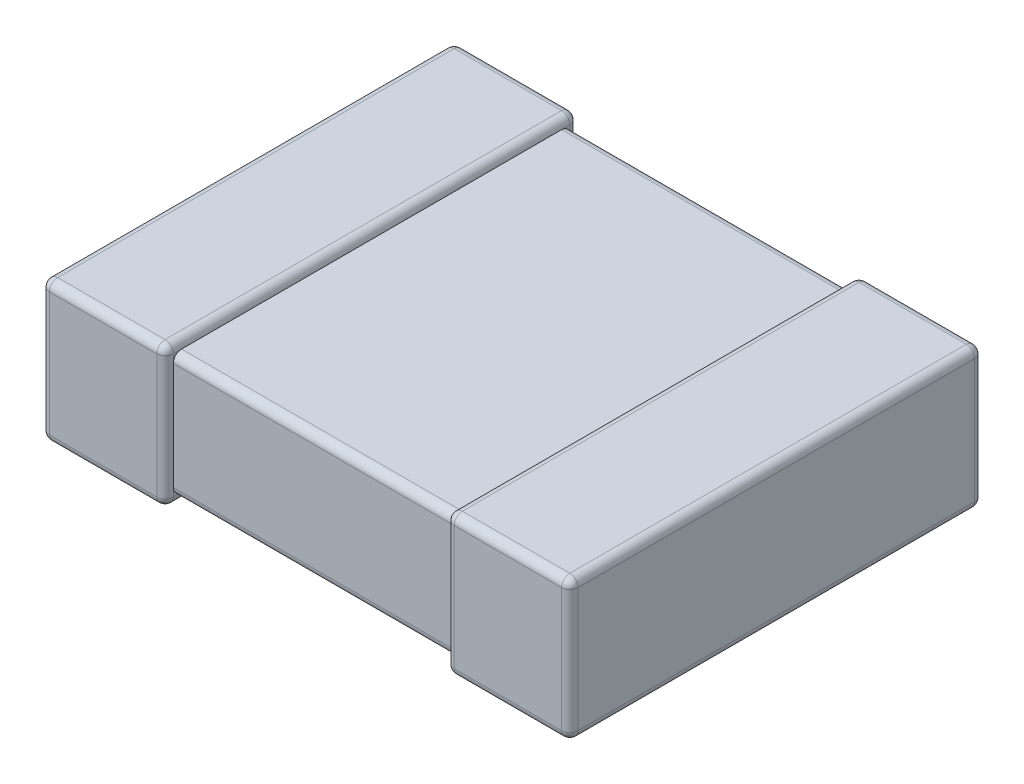
from build123d import *

# Parameters (mm, degrees)
SKETCH1_W             = 3.1
SKETCH1_H             = 2.4
BOSS_EXTRUDE1_DEPTH   = 0.75
SKETCH2_W             = 0.75
SKETCH2_H             = 2.5
BOSS_EXTRUDE2_DEPTH   = 0.85
BOSS_EXTRUDE2_2_DEPTH = 0.85
FILLET1_R             = 0.05
FILLET2_R             = 0.05
FILLET3_R             = 0.05


with BuildPart() as part:
    # Sketch1 → Boss-Extrude1 (new body)
    with BuildSketch(Plane(origin=(0, 0.05, 0), x_dir=(1, 0, 0), z_dir=(0, 1, 0))):
        Rectangle(SKETCH1_W, SKETCH1_H)
    extrude(amount=BOSS_EXTRUDE1_DEPTH)

    # Fillet3
    fillet3_edges = [part.edges().sort_by_distance(p)[0] for p in [
        (1.55, 0.8, 0),
        (0, 0.8, -1.2),
        (-1.55, 0.8, 0),
        (0, 0.05, -1.2),
        (1.55, 0.05, 0),
        (0, 0.05, 1.2),
        (-1.55, 0.05, 0),
        (-1.55, 0.425, -1.2),
        (1.55, 0.425, -1.2),
        (1.55, 0.425, 1.2),
        (-1.55, 0.425, 1.2),
        (0, 0.8, 1.2),
    ]]
    fillet(fillet3_edges, radius=FILLET3_R)


with BuildPart() as body_2:
    # Sketch2 → Boss-Extrude2 (new body)
    with BuildSketch(Plane(origin=(0, 0, 0), x_dir=(1, 0, 0), z_dir=(0, 1, 0))):
        with Locations((-1.225, 0)):
            Rectangle(SKETCH2_W, SKETCH2_H)
    extrude(amount=BOSS_EXTRUDE2_DEPTH)

    # Fillet2
    fillet2_edges = [body_2.edges().sort_by_distance(p)[0] for p in [
        (-1.6, 0.425, 1.25),
        (-1.225, 0, 1.25),
        (-0.85, 0.425, 1.25),
        (-0.85, 0, 0),
        (-0.85, 0.425, -1.25),
        (-1.225, 0, -1.25),
        (-1.225, 0.85, -1.25),
        (-1.6, 0.85, 0),
        (-1.225, 0.85, 1.25),
        (-0.85, 0.85, 0),
        (-1.6, 0.425, -1.25),
        (-1.6, 0, 0),
    ]]
    fillet(fillet2_edges, radius=FILLET2_R)


with BuildPart() as body_3:
    # Sketch2 → Boss-Extrude2 2 (new body)
    with BuildSketch(Plane(origin=(0, 0, 0), x_dir=(1, 0, 0), z_dir=(0, 1, 0))):
        with Locations((1.225, 0)):
            Rectangle(SKETCH2_W, SKETCH2_H)
    extrude(amount=BOSS_EXTRUDE2_2_DEPTH)

    # Fillet1
    fillet1_edges = [body_3.edges().sort_by_distance(p)[0] for p in [
        (0.85, 0.425, -1.25),
        (0.85, 0, 0),
        (0.85, 0.425, 1.25),
        (1.225, 0, 1.25),
        (1.6, 0.425, 1.25),
        (1.6, 0, 0),
        (1.6, 0.425, -1.25),
        (1.225, 0, -1.25),
        (1.225, 0.85, -1.25),
        (0.85, 0.85, 0),
        (1.225, 0.85, 1.25),
        (1.6, 0.85, 0),
    ]]
    fillet(fillet1_edges, radius=FILLET1_R)


solid = Compound([part.part, body_2.part, body_3.part])
